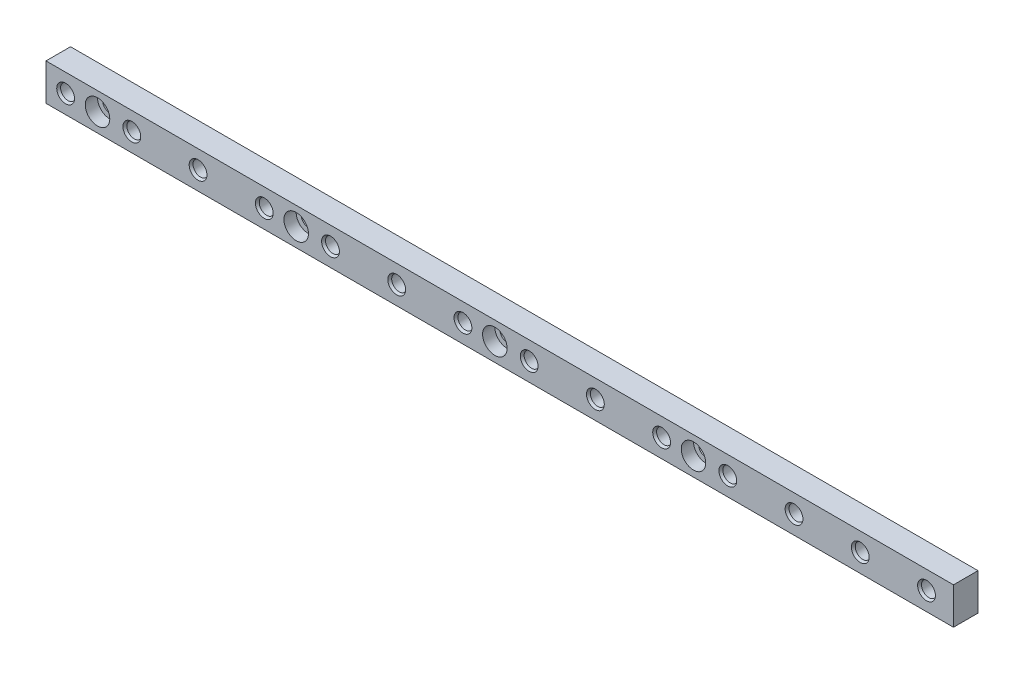
from build123d import *
from OCP.BRepFilletAPI import BRepFilletAPI_MakeChamfer

# Parameters (mm, degrees)
SKETCH_1_W                   = 370
SKETCH_1_H                   = 15
EXTRUDE_1_DEPTH              = 10
SKETCH_2_R                   = 3.05
CUT_EXTRUDE_1_DEPTH          = 371.43892884
PATTERN_LINEAR_1_COUNT       = 14
PATTERN_LINEAR_1_PITCH       = 27
HOLE_WIZARD_M5_1_D           = 5.8
HOLE_WIZARD_M5_1_CBORE_D     = 10
HOLE_WIZARD_M5_1_CBORE_DEPTH = 5
CHAMFER_1_SIZE               = 1
CHAMFER_1_SIZE2              = 0.577350269


with BuildPart() as part:
    # 草图1 → 凸台-拉伸1 (new body)
    with BuildSketch(Plane.XY):
        with Locations((185, 7.5)):
            Rectangle(SKETCH_1_W, SKETCH_1_H)
    extrude(amount=EXTRUDE_1_DEPTH)

    # 草图2 → 切除-拉伸1 (cut, through all)
    with BuildSketch(Plane.XY.offset(10)):
        with Locations((8, 7.5)):
            Circle(SKETCH_2_R)
    cut_extrude_1 = extrude(amount=-CUT_EXTRUDE_1_DEPTH, mode=Mode.SUBTRACT)

    # 阵列(线性)1: 切除-拉伸1 ×14
    with Locations(*[(i * PATTERN_LINEAR_1_PITCH, 0, 0) for i in range(1, PATTERN_LINEAR_1_COUNT)]):
        add(cut_extrude_1, mode=Mode.SUBTRACT)

    # M5 六角凹头螺钉的柱形沉头孔1 (through all)
    with Locations(Plane.XY.offset(10)):
        with Locations((21, 7.5), (102, 7.5), (183, 7.5), (264, 7.5)):
            CounterBoreHole(HOLE_WIZARD_M5_1_D / 2, HOLE_WIZARD_M5_1_CBORE_D / 2, HOLE_WIZARD_M5_1_CBORE_DEPTH)

    # 倒角1: one chamfer whose edges measure the first distance from different faces: ONE call of the kernel's chamfer builder (chamfer() names one face for all edges)
    chamfer_1_edges_1 = [part.edges().sort_by_distance(p)[0] for p in [
        (4.95, 7.5, 10),
    ]]
    chamfer_1_side_1 = [part.faces().sort_by_distance(p)[0] for p in [
        (4.95, 7.5, 5),
    ]]
    chamfer_1_edges_2 = [part.edges().sort_by_distance(p)[0] for p in [
        (31.95, 7.5, 10),
    ]]
    chamfer_1_side_2 = [part.faces().sort_by_distance(p)[0] for p in [
        (31.95, 7.5, 5),
    ]]
    chamfer_1_edges_3 = [part.edges().sort_by_distance(p)[0] for p in [
        (58.95, 7.5, 10),
    ]]
    chamfer_1_side_3 = [part.faces().sort_by_distance(p)[0] for p in [
        (58.95, 7.5, 5),
    ]]
    chamfer_1_edges_4 = [part.edges().sort_by_distance(p)[0] for p in [
        (85.95, 7.5, 10),
    ]]
    chamfer_1_side_4 = [part.faces().sort_by_distance(p)[0] for p in [
        (85.95, 7.5, 5),
    ]]
    chamfer_1_edges_5 = [part.edges().sort_by_distance(p)[0] for p in [
        (112.95, 7.5, 10),
    ]]
    chamfer_1_side_5 = [part.faces().sort_by_distance(p)[0] for p in [
        (112.95, 7.5, 5),
    ]]
    chamfer_1_edges_6 = [part.edges().sort_by_distance(p)[0] for p in [
        (139.95, 7.5, 10),
    ]]
    chamfer_1_side_6 = [part.faces().sort_by_distance(p)[0] for p in [
        (139.95, 7.5, 5),
    ]]
    chamfer_1_edges_7 = [part.edges().sort_by_distance(p)[0] for p in [
        (166.95, 7.5, 10),
    ]]
    chamfer_1_side_7 = [part.faces().sort_by_distance(p)[0] for p in [
        (166.95, 7.5, 5),
    ]]
    chamfer_1_edges_8 = [part.edges().sort_by_distance(p)[0] for p in [
        (193.95, 7.5, 10),
    ]]
    chamfer_1_side_8 = [part.faces().sort_by_distance(p)[0] for p in [
        (193.95, 7.5, 5),
    ]]
    chamfer_1_edges_9 = [part.edges().sort_by_distance(p)[0] for p in [
        (220.95, 7.5, 10),
    ]]
    chamfer_1_side_9 = [part.faces().sort_by_distance(p)[0] for p in [
        (220.95, 7.5, 5),
    ]]
    chamfer_1_edges_10 = [part.edges().sort_by_distance(p)[0] for p in [
        (247.95, 7.5, 10),
    ]]
    chamfer_1_side_10 = [part.faces().sort_by_distance(p)[0] for p in [
        (247.95, 7.5, 5),
    ]]
    chamfer_1_edges_11 = [part.edges().sort_by_distance(p)[0] for p in [
        (274.95, 7.5, 10),
    ]]
    chamfer_1_side_11 = [part.faces().sort_by_distance(p)[0] for p in [
        (274.95, 7.5, 5),
    ]]
    chamfer_1_edges_12 = [part.edges().sort_by_distance(p)[0] for p in [
        (301.95, 7.5, 10),
    ]]
    chamfer_1_side_12 = [part.faces().sort_by_distance(p)[0] for p in [
        (301.95, 7.5, 5),
    ]]
    chamfer_1_edges_13 = [part.edges().sort_by_distance(p)[0] for p in [
        (328.95, 7.5, 10),
    ]]
    chamfer_1_side_13 = [part.faces().sort_by_distance(p)[0] for p in [
        (328.95, 7.5, 5),
    ]]
    chamfer_1_edges_14 = [part.edges().sort_by_distance(p)[0] for p in [
        (355.95, 7.5, 10),
    ]]
    chamfer_1_side_14 = [part.faces().sort_by_distance(p)[0] for p in [
        (355.95, 7.5, 5),
    ]]
    chamfer_1 = BRepFilletAPI_MakeChamfer(part.part.solid().wrapped)
    for e in chamfer_1_edges_1:
        chamfer_1.Add(CHAMFER_1_SIZE, CHAMFER_1_SIZE2, e.wrapped, chamfer_1_side_1[0].wrapped)  # the first distance lies on this face
    for e in chamfer_1_edges_2:
        chamfer_1.Add(CHAMFER_1_SIZE, CHAMFER_1_SIZE2, e.wrapped, chamfer_1_side_2[0].wrapped)  # the first distance lies on this face
    for e in chamfer_1_edges_3:
        chamfer_1.Add(CHAMFER_1_SIZE, CHAMFER_1_SIZE2, e.wrapped, chamfer_1_side_3[0].wrapped)  # the first distance lies on this face
    for e in chamfer_1_edges_4:
        chamfer_1.Add(CHAMFER_1_SIZE, CHAMFER_1_SIZE2, e.wrapped, chamfer_1_side_4[0].wrapped)  # the first distance lies on this face
    for e in chamfer_1_edges_5:
        chamfer_1.Add(CHAMFER_1_SIZE, CHAMFER_1_SIZE2, e.wrapped, chamfer_1_side_5[0].wrapped)  # the first distance lies on this face
    for e in chamfer_1_edges_6:
        chamfer_1.Add(CHAMFER_1_SIZE, CHAMFER_1_SIZE2, e.wrapped, chamfer_1_side_6[0].wrapped)  # the first distance lies on this face
    for e in chamfer_1_edges_7:
        chamfer_1.Add(CHAMFER_1_SIZE, CHAMFER_1_SIZE2, e.wrapped, chamfer_1_side_7[0].wrapped)  # the first distance lies on this face
    for e in chamfer_1_edges_8:
        chamfer_1.Add(CHAMFER_1_SIZE, CHAMFER_1_SIZE2, e.wrapped, chamfer_1_side_8[0].wrapped)  # the first distance lies on this face
    for e in chamfer_1_edges_9:
        chamfer_1.Add(CHAMFER_1_SIZE, CHAMFER_1_SIZE2, e.wrapped, chamfer_1_side_9[0].wrapped)  # the first distance lies on this face
    for e in chamfer_1_edges_10:
        chamfer_1.Add(CHAMFER_1_SIZE, CHAMFER_1_SIZE2, e.wrapped, chamfer_1_side_10[0].wrapped)  # the first distance lies on this face
    for e in chamfer_1_edges_11:
        chamfer_1.Add(CHAMFER_1_SIZE, CHAMFER_1_SIZE2, e.wrapped, chamfer_1_side_11[0].wrapped)  # the first distance lies on this face
    for e in chamfer_1_edges_12:
        chamfer_1.Add(CHAMFER_1_SIZE, CHAMFER_1_SIZE2, e.wrapped, chamfer_1_side_12[0].wrapped)  # the first distance lies on this face
    for e in chamfer_1_edges_13:
        chamfer_1.Add(CHAMFER_1_SIZE, CHAMFER_1_SIZE2, e.wrapped, chamfer_1_side_13[0].wrapped)  # the first distance lies on this face
    for e in chamfer_1_edges_14:
        chamfer_1.Add(CHAMFER_1_SIZE, CHAMFER_1_SIZE2, e.wrapped, chamfer_1_side_14[0].wrapped)  # the first distance lies on this face
    add(Compound.cast(chamfer_1.Shape()), mode=Mode.REPLACE)


solid = part.part
